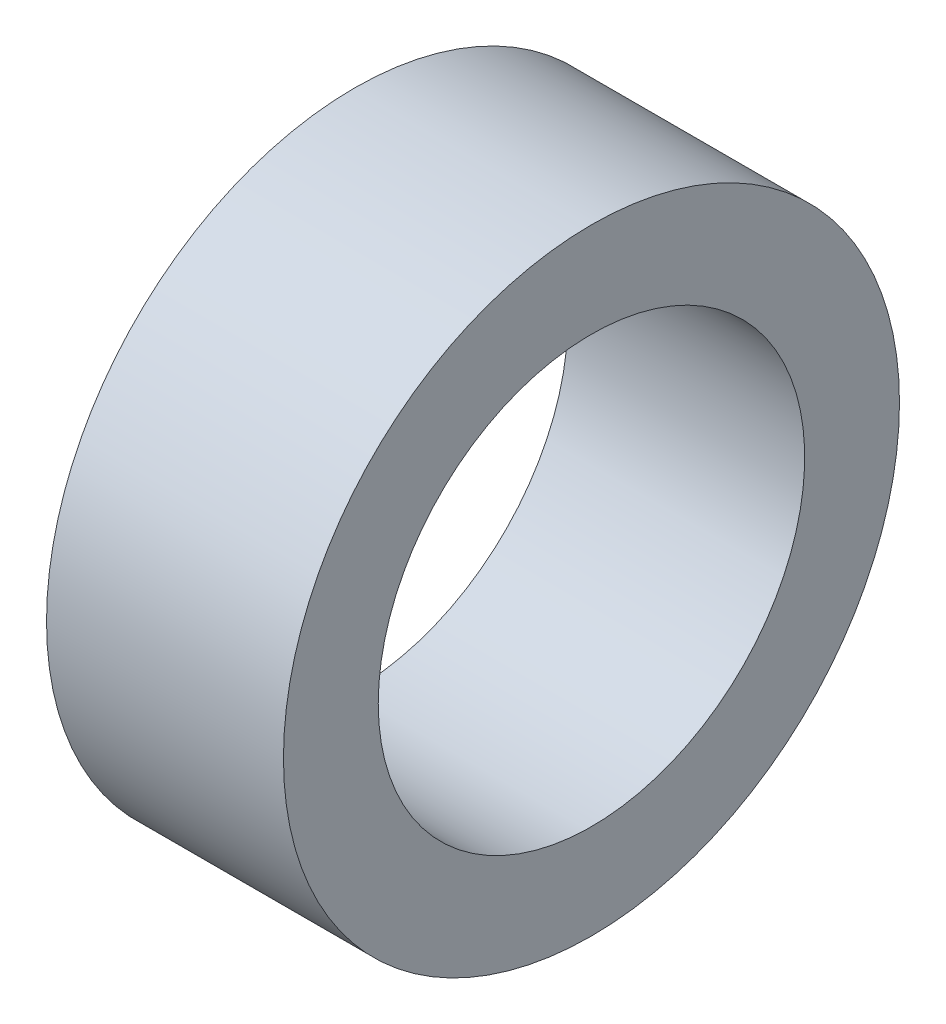
from build123d import *

# Parameters (mm, degrees)
SKETCH_1_W = 10
SKETCH_1_H = 4


with BuildPart() as part:
    # 草图1 → 01_PACKING (revolve)
    with BuildSketch(Plane.XY, mode=Mode.PRIVATE) as f_01_packing_sk:
        with Locations((5, 11)):
            Rectangle(SKETCH_1_W, SKETCH_1_H)
    revolve(f_01_packing_sk.sketch.rotate(Axis((-5, 0, 0), (1, 0, 0)), 90), axis=Axis((-5, 0, 0), (1, 0, 0)))


solid = part.part
